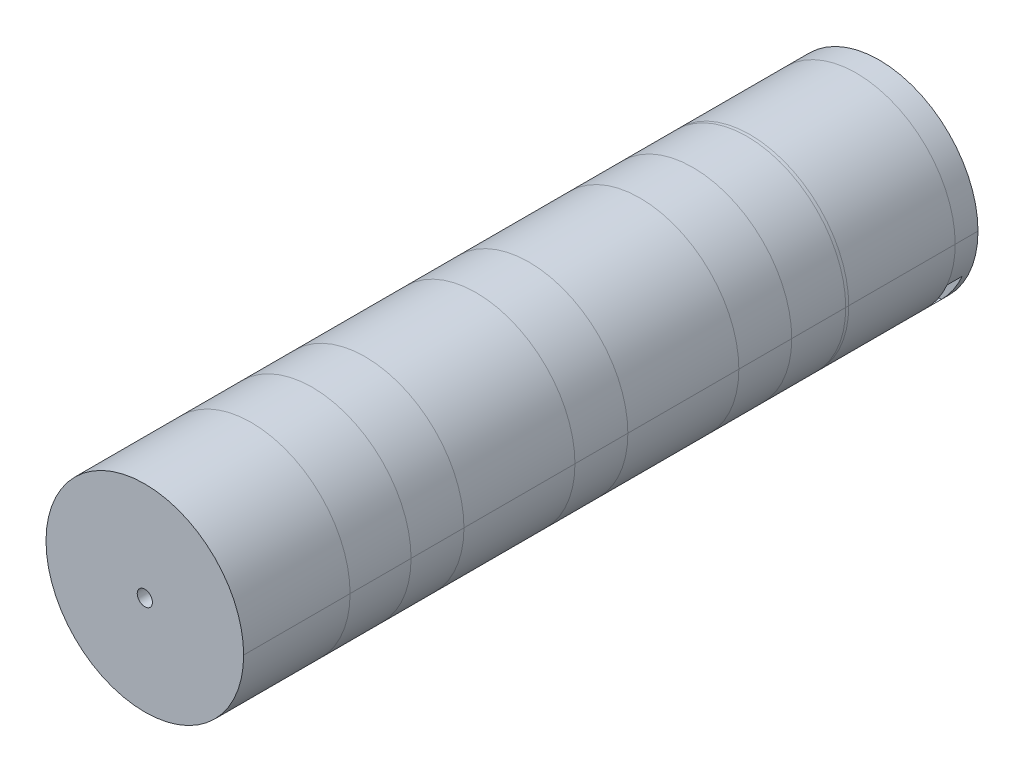
from build123d import *

# Parameters (mm, degrees)
EXTRUDEASSE_DEPTH      = 468
EXTRUDEASSE_DEPTH_BACK = 15
SKETCH1_R              = 65
SKETCH6_W              = 125.765742684
SKETCH6_H              = 20
CUT_EXTRUDE1_DEPTH     = 10


with BuildPart() as part:
    # Sketch1 → ExtrudeAsse (new, two sides: drawn at the far end of the back side and taken through both)
    with BuildSketch(Plane.XY.offset(-EXTRUDEASSE_DEPTH_BACK)):
        Circle(SKETCH1_R)
    extrude(amount=EXTRUDEASSE_DEPTH + EXTRUDEASSE_DEPTH_BACK)

    # Sketch3 → Cut-Revolve1 (revolve, cut)
    with BuildSketch(Plane(origin=(0, 0, 0), x_dir=(0, 0, -1), z_dir=(0.7071067811865414, -0.7071067811865537, 0)), mode=Mode.PRIVATE) as cut_revolve1_sk:
        Polygon((-227.7, -65), (-227.7, 10), (-232.7, 12.886751346), (-232.7, 0), (-232.7, -65), align=None)
    revolve(cut_revolve1_sk.sketch.rotate(Axis((0, 0, 232.7), (-0.7071067811865537, -0.7071067811865414, 0)), 90), axis=Axis((0, 0, 232.7), (-0.7071067811865537, -0.7071067811865414, 0)), mode=Mode.SUBTRACT)

    # Sketch3<3> → Cut-Revolve2 (revolve, cut)
    with BuildSketch(Plane(origin=(0, 0, 0), x_dir=(0, 0, -1), z_dir=(0.7071067811865414, -0.7071067811865537, 0)), mode=Mode.PRIVATE) as cut_revolve2_sk:
        Polygon((-340.5, 10), (-340.5, -65), (-335.5, -65), (-335.5, 10), (-340.5, 12.886751346), align=None)
    revolve(cut_revolve2_sk.sketch.rotate(Axis((7.071067812, 7.071067812, 340.5), (-0.7071067811865537, -0.7071067811865415, 0)), 90), axis=Axis((7.071067812, 7.071067812, 340.5), (-0.7071067811865537, -0.7071067811865415, 0)), mode=Mode.SUBTRACT)

    # Sketch4 → Cut-Revolve5 (revolve, cut)
    with BuildSketch(Plane(origin=(0, 0, 0), x_dir=(0, 0, -1), z_dir=(1, 0, 0)), mode=Mode.PRIVATE) as cut_revolve5_sk:
        Polygon((-468, 0), (-197.77110668, 0), (-194.884355334, 0), (-197.77110668, -5), (-468, -5), align=None)
    revolve(cut_revolve5_sk.sketch.rotate(Axis((0, 0, 0), (0, 0, 1)), 225), axis=Axis((0, 0, 0), (0, 0, 1)), mode=Mode.SUBTRACT)

    # Sketch5 → Cut-Revolve6 (revolve, cut)
    with BuildSketch(Plane(origin=(0, 0, 0), x_dir=(0, 0, -1), z_dir=(1, 0, 0)), mode=Mode.PRIVATE) as cut_revolve6_sk:
        Polygon((15, -5), (15, 0), (-162.113248654, 0), (-165, 0), (-162.113248654, -5), align=None)
    revolve(cut_revolve6_sk.sketch.rotate(Axis((0, 0, 0), (0, 0, 1)), 270), axis=Axis((0, 0, 0), (0, 0, 1)), mode=Mode.SUBTRACT)

    # Sketch3<5> → Cut-Revolve7 (revolve, cut)
    with BuildSketch(Plane(origin=(0, 0, 0), x_dir=(0, 0, -1), z_dir=(0.7071067811865414, -0.7071067811865537, 0)), mode=Mode.PRIVATE) as cut_revolve7_sk:
        Polygon((-124.9, 10), (-124.9, 12.886751346), (-119.9, 10), (-119.9, -65), (-124.9, -65), align=None)
    revolve(cut_revolve7_sk.sketch.rotate(Axis((-45.961940777, -45.961940777, 124.9), (0.7071067811865537, 0.7071067811865415, 0)), 270), axis=Axis((-45.961940777, -45.961940777, 124.9), (0.7071067811865537, 0.7071067811865415, 0)), mode=Mode.SUBTRACT)

    # Sketch6 → Cut-Extrude1 (cut)
    with BuildSketch(Plane(origin=(0, 0, 0), x_dir=(-1, 0, 0), z_dir=(0, 0, -1))):
        with Locations((-8.867505506, -35.961940777)):
            Rectangle(SKETCH6_W, SKETCH6_H)
    extrude(amount=CUT_EXTRUDE1_DEPTH, mode=Mode.SUBTRACT)


solid = part.part
